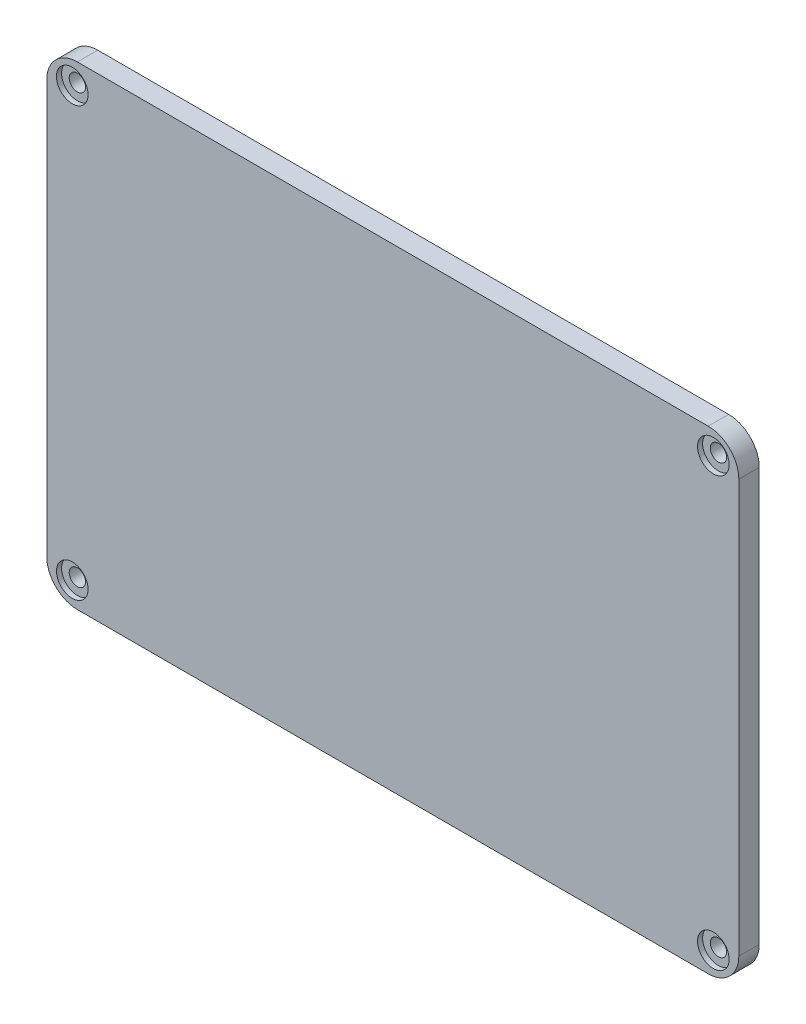
from build123d import *

# Parameters (mm, degrees)
SKETCH1_R           = 1.6
BOSS_EXTRUDE1_DEPTH = 4
SKETCH2_R           = 3.1
CUT_EXTRUDE1_DEPTH  = 1


with BuildPart() as part:
    # Sketch1 → Boss-Extrude1 (new body)
    with BuildSketch(Plane.XY):
        with BuildLine():
            Line((-12.204375178, -60.110154246), (-12.204375178, -141.110154246))
            ThreePointArc((-12.204375178, -141.110154246), (-10.447015865, -145.352794933), (-6.204375178, -147.110154246))
            Line((-6.204375178, -147.110154246), (117.495624822, -147.110154246))
            ThreePointArc((117.495624822, -147.110154246), (121.738265509, -145.352794933), (123.495624822, -141.110154246))
            Line((123.495624822, -141.110154246), (123.495624822, -60.110154246))
            ThreePointArc((123.495624822, -60.110154246), (121.738265509, -55.867513558), (117.495624822, -54.110154246))
            Line((117.495624822, -54.110154246), (-6.204375178, -54.110154246))
            ThreePointArc((-6.204375178, -54.110154246), (-10.447015865, -55.867513558), (-12.204375178, -60.110154246))
        make_face()
        with Locations((-7.204375178, -58.610154246)):
            Circle(SKETCH1_R, mode=Mode.SUBTRACT)
        with Locations((118.495624822, -58.610154246)):
            Circle(SKETCH1_R, mode=Mode.SUBTRACT)
        with Locations((118.495624822, -142.610154246)):
            Circle(SKETCH1_R, mode=Mode.SUBTRACT)
        with Locations((-7.204375178, -142.610154246)):
            Circle(SKETCH1_R, mode=Mode.SUBTRACT)
    extrude(amount=BOSS_EXTRUDE1_DEPTH)

    # Sketch2 → Cut-Extrude1 (cut)
    with BuildSketch(Plane.XY.offset(4)):
        with Locations((-7.204375178, -58.610154246)):
            Circle(SKETCH2_R)
        with Locations(Location((118.495624822, -58.610154246, 0), (0, 0, 180))):
            Circle(SKETCH2_R)
        with Locations((118.495624822, -142.610154246)):
            Circle(SKETCH2_R)
        with Locations(Location((-7.204375178, -142.610154246, 0), (0, 0, 180))):
            Circle(SKETCH2_R)
    extrude(amount=-CUT_EXTRUDE1_DEPTH, mode=Mode.SUBTRACT)


solid = part.part
